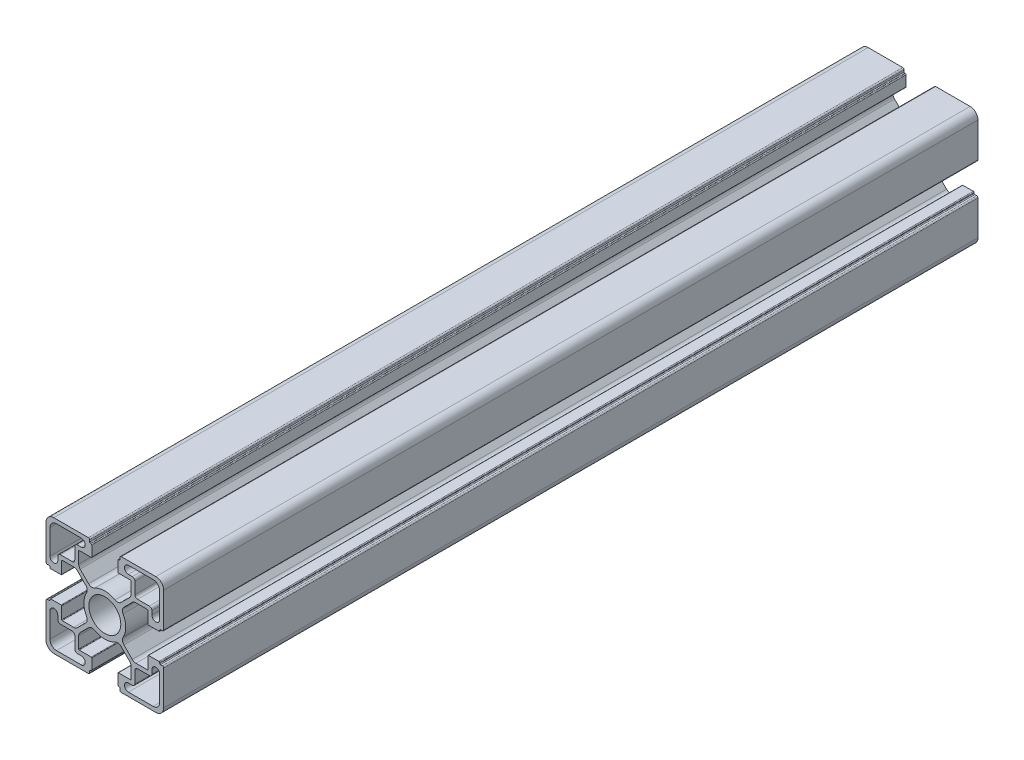
from build123d import *

# Parameters (mm, degrees)
BOSS_EXTRUDE1_DEPTH = 311.45574968
SCALE1_SCALE        = 0.5644444


with BuildPart() as part:
    # Sketch1 → Boss-Extrude1 (new body)
    with BuildSketch(Plane.XY):
        with BuildLine():
            Line((-22.5, 19.5), (-22.5, 6.3))
            ThreePointArc((-22.5, 6.3), (-22.353553391, 5.946446609), (-22, 5.8))
            Line((-22, 5.8), (-21.3, 5.8))
            ThreePointArc((-21.3, 5.8), (-21.087867966, 5.712132034), (-21, 5.5))
            Line((-21, 5.5), (-21, 5.3))
            ThreePointArc((-21, 5.3), (-20.912132034, 5.087867966), (-20.7, 5))
            Line((-20.7, 5), (-16.7, 5))
            ThreePointArc((-16.7, 5), (-16.558578644, 5.058578644), (-16.5, 5.2))
            Line((-16.5, 5.2), (-16.5, 9.8))
            ThreePointArc((-16.5, 9.8), (-16.441421356, 9.941421356), (-16.3, 10))
            Line((-16.3, 10), (-11.864234483, 10))
            ThreePointArc((-11.864234483, 10), (-11.121828624, 9.852326293), (-10.492447327, 9.431787156))
            Line((-10.492447327, 9.431787156), (-7.296699127, 6.236038955))
            ThreePointArc((-7.296699127, 6.236038955), (-6.746669172, 5.129240469), (-6.976648919, 3.914890784))
            ThreePointArc((-6.976648919, 3.914890784), (-7.739935121, 2.023216331), (-8, 0))
            ThreePointArc((-8, 0), (-7.739935121, -2.023216331), (-6.976648919, -3.914890784))
            ThreePointArc((-6.976648919, -3.914890784), (-6.746669172, -5.129240469), (-7.296699127, -6.236038955))
            Line((-7.296699127, -6.236038955), (-10.492447327, -9.431787156))
            ThreePointArc((-10.492447327, -9.431787156), (-11.121828624, -9.852326293), (-11.864234483, -10))
            Line((-11.864234483, -10), (-16.3, -10))
            ThreePointArc((-16.3, -10), (-16.441421356, -9.941421356), (-16.5, -9.8))
            Line((-16.5, -9.8), (-16.5, -5.2))
            ThreePointArc((-16.5, -5.2), (-16.558578644, -5.058578644), (-16.7, -5))
            Line((-16.7, -5), (-20.7, -5))
            ThreePointArc((-20.7, -5), (-20.912132034, -5.087867966), (-21, -5.3))
            Line((-21, -5.3), (-21, -5.5))
            ThreePointArc((-21, -5.5), (-21.087867966, -5.712132034), (-21.3, -5.8))
            Line((-21.3, -5.8), (-22, -5.8))
            ThreePointArc((-22, -5.8), (-22.353553391, -5.946446609), (-22.5, -6.3))
            Line((-22.5, -6.3), (-22.5, -19.5))
            ThreePointArc((-22.5, -19.5), (-21.621320344, -21.621320344), (-19.5, -22.5))
            Line((-19.5, -22.5), (-6.3, -22.5))
            ThreePointArc((-6.3, -22.5), (-5.946446609, -22.353553391), (-5.8, -22))
            Line((-5.8, -22), (-5.8, -21.3))
            ThreePointArc((-5.8, -21.3), (-5.712132034, -21.087867966), (-5.5, -21))
            Line((-5.5, -21), (-5.3, -21))
            ThreePointArc((-5.3, -21), (-5.087867966, -20.912132034), (-5, -20.7))
            Line((-5, -20.7), (-5, -16.7))
            ThreePointArc((-5, -16.7), (-5.058578644, -16.558578644), (-5.2, -16.5))
            Line((-5.2, -16.5), (-9.8, -16.5))
            ThreePointArc((-9.8, -16.5), (-9.941421356, -16.441421356), (-10, -16.3))
            Line((-10, -16.3), (-10, -11.864234483))
            ThreePointArc((-10, -11.864234483), (-9.852326293, -11.121828624), (-9.431787156, -10.492447327))
            Line((-9.431787156, -10.492447327), (-6.236038955, -7.296699127))
            ThreePointArc((-6.236038955, -7.296699127), (-5.129240469, -6.746669172), (-3.914890784, -6.976648919))
            ThreePointArc((-3.914890784, -6.976648919), (-2.023216331, -7.739935121), (0, -8))
            ThreePointArc((0, -8), (2.023216331, -7.739935121), (3.914890784, -6.976648919))
            ThreePointArc((3.914890784, -6.976648919), (5.129240469, -6.746669172), (6.236038955, -7.296699127))
            Line((6.236038955, -7.296699127), (9.431787156, -10.492447327))
            ThreePointArc((9.431787156, -10.492447327), (9.852326293, -11.121828624), (10, -11.864234483))
            Line((10, -11.864234483), (10, -16.3))
            ThreePointArc((10, -16.3), (9.941421356, -16.441421356), (9.8, -16.5))
            Line((9.8, -16.5), (5.2, -16.5))
            ThreePointArc((5.2, -16.5), (5.058578644, -16.558578644), (5, -16.7))
            Line((5, -16.7), (5, -20.7))
            ThreePointArc((5, -20.7), (5.087867966, -20.912132034), (5.3, -21))
            Line((5.3, -21), (5.5, -21))
            ThreePointArc((5.5, -21), (5.712132034, -21.087867966), (5.8, -21.3))
            Line((5.8, -21.3), (5.8, -22))
            ThreePointArc((5.8, -22), (5.946446609, -22.353553391), (6.3, -22.5))
            Line((6.3, -22.5), (19.5, -22.5))
            ThreePointArc((19.5, -22.5), (21.621320344, -21.621320344), (22.5, -19.5))
            Line((22.5, -19.5), (22.5, -6.3))
            ThreePointArc((22.5, -6.3), (22.353553391, -5.946446609), (22, -5.8))
            Line((22, -5.8), (21.3, -5.8))
            ThreePointArc((21.3, -5.8), (21.087867966, -5.712132034), (21, -5.5))
            Line((21, -5.5), (21, -5.3))
            ThreePointArc((21, -5.3), (20.912132034, -5.087867966), (20.7, -5))
            Line((20.7, -5), (16.7, -5))
            ThreePointArc((16.7, -5), (16.558578644, -5.058578644), (16.5, -5.2))
            Line((16.5, -5.2), (16.5, -9.8))
            ThreePointArc((16.5, -9.8), (16.441421356, -9.941421356), (16.3, -10))
            Line((16.3, -10), (11.864234483, -10))
            ThreePointArc((11.864234483, -10), (11.121828624, -9.852326293), (10.492447327, -9.431787156))
            Line((10.492447327, -9.431787156), (7.296699127, -6.236038955))
            ThreePointArc((7.296699127, -6.236038955), (6.746669172, -5.129240469), (6.976648919, -3.914890784))
            ThreePointArc((6.976648919, -3.914890784), (7.739935121, -2.023216331), (8, 0))
            ThreePointArc((8, 0), (7.739935121, 2.023216331), (6.976648919, 3.914890784))
            ThreePointArc((6.976648919, 3.914890784), (6.746669172, 5.129240469), (7.296699127, 6.236038955))
            Line((7.296699127, 6.236038955), (10.492447327, 9.431787156))
            ThreePointArc((10.492447327, 9.431787156), (11.121828624, 9.852326293), (11.864234483, 10))
            Line((11.864234483, 10), (16.3, 10))
            ThreePointArc((16.3, 10), (16.441421356, 9.941421356), (16.5, 9.8))
            Line((16.5, 9.8), (16.5, 5.2))
            ThreePointArc((16.5, 5.2), (16.558578644, 5.058578644), (16.7, 5))
            Line((16.7, 5), (20.7, 5))
            ThreePointArc((20.7, 5), (20.912132034, 5.087867966), (21, 5.3))
            Line((21, 5.3), (21, 5.5))
            ThreePointArc((21, 5.5), (21.087867966, 5.712132034), (21.3, 5.8))
            Line((21.3, 5.8), (22, 5.8))
            ThreePointArc((22, 5.8), (22.353553391, 5.946446609), (22.5, 6.3))
            Line((22.5, 6.3), (22.5, 19.5))
            ThreePointArc((22.5, 19.5), (21.621320344, 21.621320344), (19.5, 22.5))
            Line((19.5, 22.5), (6.3, 22.5))
            ThreePointArc((6.3, 22.5), (5.946446609, 22.353553391), (5.8, 22))
            Line((5.8, 22), (5.8, 21.3))
            ThreePointArc((5.8, 21.3), (5.712132034, 21.087867966), (5.5, 21))
            Line((5.5, 21), (5.3, 21))
            ThreePointArc((5.3, 21), (5.087867966, 20.912132034), (5, 20.7))
            Line((5, 20.7), (5, 16.7))
            ThreePointArc((5, 16.7), (5.058578644, 16.558578644), (5.2, 16.5))
            Line((5.2, 16.5), (9.8, 16.5))
            ThreePointArc((9.8, 16.5), (9.941421356, 16.441421356), (10, 16.3))
            Line((10, 16.3), (10, 11.864234483))
            ThreePointArc((10, 11.864234483), (9.852326293, 11.121828624), (9.431787156, 10.492447327))
            Line((9.431787156, 10.492447327), (6.236038955, 7.296699127))
            ThreePointArc((6.236038955, 7.296699127), (5.129240469, 6.746669172), (3.914890784, 6.976648919))
            ThreePointArc((3.914890784, 6.976648919), (2.023216331, 7.739935121), (0, 8))
            ThreePointArc((0, 8), (-2.023216331, 7.739935121), (-3.914890784, 6.976648919))
            ThreePointArc((-3.914890784, 6.976648919), (-5.129240469, 6.746669172), (-6.236038955, 7.296699127))
            Line((-6.236038955, 7.296699127), (-9.431787156, 10.492447327))
            ThreePointArc((-9.431787156, 10.492447327), (-9.852326293, 11.121828624), (-10, 11.864234483))
            Line((-10, 11.864234483), (-10, 16.3))
            ThreePointArc((-10, 16.3), (-9.941421356, 16.441421356), (-9.8, 16.5))
            Line((-9.8, 16.5), (-5.2, 16.5))
            ThreePointArc((-5.2, 16.5), (-5.058578644, 16.558578644), (-5, 16.7))
            Line((-5, 16.7), (-5, 20.7))
            ThreePointArc((-5, 20.7), (-5.087867966, 20.912132034), (-5.3, 21))
            Line((-5.3, 21), (-5.5, 21))
            ThreePointArc((-5.5, 21), (-5.712132034, 21.087867966), (-5.8, 21.3))
            Line((-5.8, 21.3), (-5.8, 22))
            ThreePointArc((-5.8, 22), (-5.946446609, 22.353553391), (-6.3, 22.5))
            Line((-6.3, 22.5), (-19.5, 22.5))
            ThreePointArc((-19.5, 22.5), (-21.621320344, 21.621320344), (-22.5, 19.5))
        make_face()
        with BuildLine():
            Line((-21, 18.5), (-21, 9))
            ThreePointArc((-21, 9), (-19.5, 7.5), (-18, 9))
            Line((-18, 9), (-18, 10.5))
            ThreePointArc((-18, 10.5), (-17.707106781, 11.207106781), (-17, 11.5))
            Line((-17, 11.5), (-12.5, 11.5))
            ThreePointArc((-12.5, 11.5), (-11.792893219, 11.792893219), (-11.5, 12.5))
            Line((-11.5, 12.5), (-11.5, 17))
            ThreePointArc((-11.5, 17), (-11.207106781, 17.707106781), (-10.5, 18))
            Line((-10.5, 18), (-9, 18))
            ThreePointArc((-9, 18), (-7.5, 19.5), (-9, 21))
            Line((-9, 21), (-18.5, 21))
            ThreePointArc((-18.5, 21), (-20.267766953, 20.267766953), (-21, 18.5))
        make_face(mode=Mode.SUBTRACT)
        with BuildLine():
            Line((18.5, 21), (9, 21))
            ThreePointArc((9, 21), (7.5, 19.5), (9, 18))
            Line((9, 18), (10.5, 18))
            ThreePointArc((10.5, 18), (11.207106781, 17.707106781), (11.5, 17))
            Line((11.5, 17), (11.5, 12.5))
            ThreePointArc((11.5, 12.5), (11.792893219, 11.792893219), (12.5, 11.5))
            Line((12.5, 11.5), (17, 11.5))
            ThreePointArc((17, 11.5), (17.707106781, 11.207106781), (18, 10.5))
            Line((18, 10.5), (18, 9))
            ThreePointArc((18, 9), (19.5, 7.5), (21, 9))
            Line((21, 9), (21, 18.5))
            ThreePointArc((21, 18.5), (20.267766953, 20.267766953), (18.5, 21))
        make_face(mode=Mode.SUBTRACT)
        with BuildLine():
            Line((21, -18.5), (21, -9))
            ThreePointArc((21, -9), (19.5, -7.5), (18, -9))
            Line((18, -9), (18, -10.5))
            ThreePointArc((18, -10.5), (17.707106781, -11.207106781), (17, -11.5))
            Line((17, -11.5), (12.5, -11.5))
            ThreePointArc((12.5, -11.5), (11.792893219, -11.792893219), (11.5, -12.5))
            Line((11.5, -12.5), (11.5, -17))
            ThreePointArc((11.5, -17), (11.207106781, -17.707106781), (10.5, -18))
            Line((10.5, -18), (9, -18))
            ThreePointArc((9, -18), (7.5, -19.5), (9, -21))
            Line((9, -21), (18.5, -21))
            ThreePointArc((18.5, -21), (20.267766953, -20.267766953), (21, -18.5))
        make_face(mode=Mode.SUBTRACT)
        with BuildLine():
            Line((-18.5, -21), (-9, -21))
            ThreePointArc((-9, -21), (-7.5, -19.5), (-9, -18))
            Line((-9, -18), (-10.5, -18))
            ThreePointArc((-10.5, -18), (-11.207106781, -17.707106781), (-11.5, -17))
            Line((-11.5, -17), (-11.5, -12.5))
            ThreePointArc((-11.5, -12.5), (-11.792893219, -11.792893219), (-12.5, -11.5))
            Line((-12.5, -11.5), (-17, -11.5))
            ThreePointArc((-17, -11.5), (-17.707106781, -11.207106781), (-18, -10.5))
            Line((-18, -10.5), (-18, -9))
            ThreePointArc((-18, -9), (-19.5, -7.5), (-21, -9))
            Line((-21, -9), (-21, -18.5))
            ThreePointArc((-21, -18.5), (-20.267766953, -20.267766953), (-18.5, -21))
        make_face(mode=Mode.SUBTRACT)
        with BuildLine():
            ThreePointArc((0, 6.1), (-4.313351365, 4.313351365), (-6.1, 0))
            ThreePointArc((-6.1, 0), (-4.313351365, -4.313351365), (0, -6.1))
            ThreePointArc((0, -6.1), (4.313351365, -4.313351365), (6.1, 0))
            ThreePointArc((6.1, 0), (4.313351365, 4.313351365), (0, 6.1))
        make_face(mode=Mode.SUBTRACT)
    extrude(amount=BOSS_EXTRUDE1_DEPTH)


with BuildPart() as part_1:
    # Scale1: scaled about (0, 0, 155.72787484)
    add(part.part.scale(SCALE1_SCALE).moved(Location((0, 0, 67.828147963))))


solid = part_1.part
